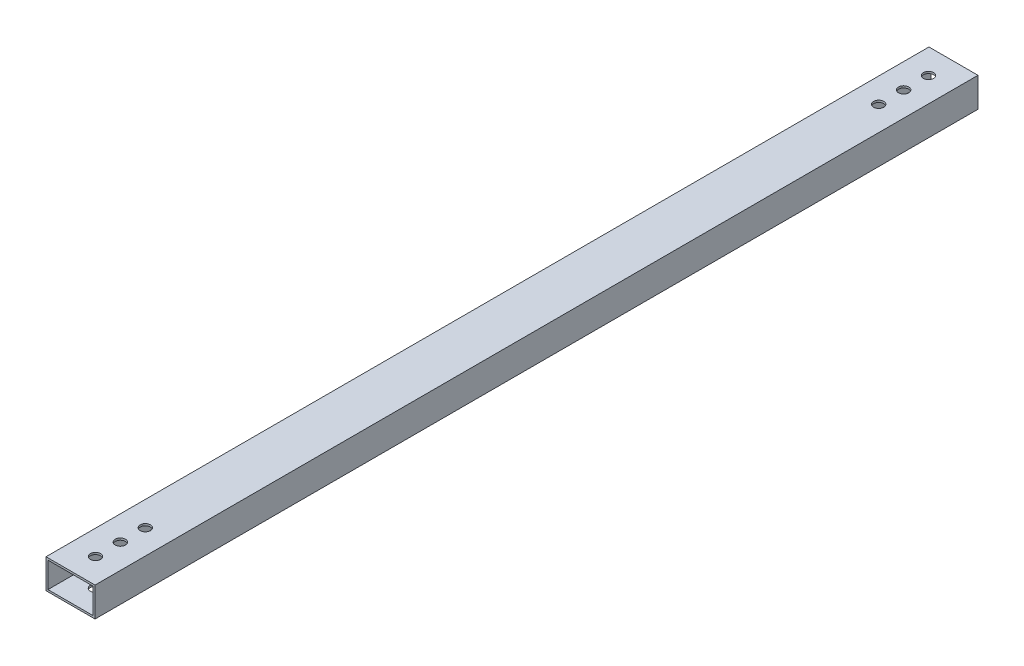
from build123d import *

# Parameters (mm, degrees)
SKETCH_1_W          = 25
SKETCH_1_H          = 15
SKETCH_1_W_2        = 23
SKETCH_1_H_2        = 13
EXTRUDE_1_DEPTH     = 450
SKETCH_2_R          = 2.6
CUT_EXTRUDE_1_DEPTH = 451.423411914


with BuildPart() as part:
    # ｽｹｯﾁ1 → ﾎﾞｽ - 押し出し1 (new body)
    with BuildSketch(Plane.XY):
        Rectangle(SKETCH_1_W, SKETCH_1_H)
        Rectangle(SKETCH_1_W_2, SKETCH_1_H_2, mode=Mode.SUBTRACT)
    extrude(amount=EXTRUDE_1_DEPTH)

    # ｽｹｯﾁ2 → ｶｯﾄ - 押し出し1 (cut, through all)
    with BuildSketch(Plane(origin=(0, 7.5, 0), x_dir=(1, 0, 0), z_dir=(0, 1, 0))):
        with Locations(Location((0, -12.7, 0), (0, 0, 270))):
            Circle(SKETCH_2_R)
        with Locations(Location((0, -25.4, 0), (0, 0, 270))):
            Circle(SKETCH_2_R)
        with Locations(Location((0, -38.1, 0), (0, 0, 270))):
            Circle(SKETCH_2_R)
    cut_extrude_1 = extrude(amount=-CUT_EXTRUDE_1_DEPTH, mode=Mode.SUBTRACT)

    # ﾐﾗｰ1: ｶｯﾄ - 押し出し1 across plane
    add(cut_extrude_1.mirror(Plane(origin=(0, 0, 225), x_dir=(1, 0, 0), z_dir=(0, 0, -1))), mode=Mode.SUBTRACT)


solid = part.part
